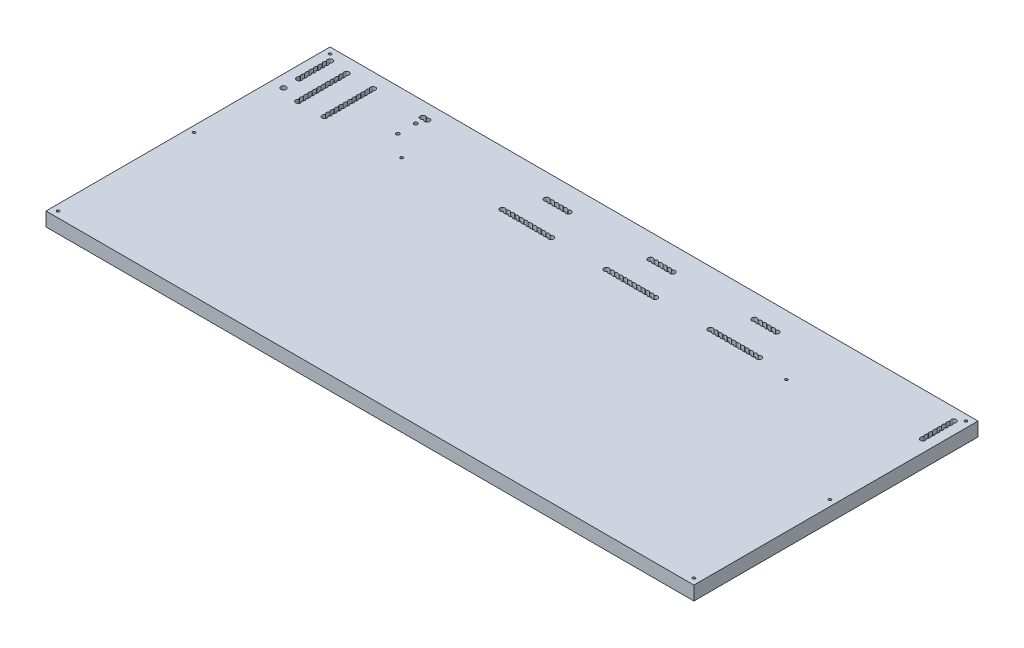
from build123d import *

# Parameters (mm, degrees)
SKETCH_1_W      = 374
SKETCH_1_H      = 164
SKETCH_1_R      = 0.7835
SKETCH_1_R_2    = 1.5
SKETCH_1_R_3    = 1
EXTRUDE_1_DEPTH = 8


with BuildPart() as part:
    # 草图1 → 凸台-拉伸1 (new body)
    with BuildSketch(Plane(origin=(0, 0, 0), x_dir=(1, 0, 0), z_dir=(0, 1, 0))):
        Rectangle(SKETCH_1_W, SKETCH_1_H)
        with Locations(Location((-183.5, -78.5, 0), (0, 0, 270))):
            Circle(SKETCH_1_R, mode=Mode.SUBTRACT)
        with Locations(Location((183.5, -78.5, 0), (0, 0, 270))):
            Circle(SKETCH_1_R, mode=Mode.SUBTRACT)
        with Locations(Location((-183.5, 0, 0), (0, 0, 270))):
            Circle(SKETCH_1_R, mode=Mode.SUBTRACT)
        with Locations(Location((-180, 48.1, 0), (0, 0, 270))):
            Circle(SKETCH_1_R_2, mode=Mode.SUBTRACT)
        with BuildLine():
            ThreePointArc((-169.796185442, 72.253), (-169.723507352, 74.835874359), (-167.498, 73.523))
            ThreePointArc((-167.498, 73.523), (-167.685125641, 72.797492648), (-168.199814558, 72.253))
            ThreePointArc((-168.199814558, 72.253), (-167.685125641, 71.708507352), (-167.498, 70.983))
            ThreePointArc((-167.498, 70.983), (-167.685125641, 70.257492648), (-168.199814558, 69.713))
            ThreePointArc((-168.199814558, 69.713), (-167.685125641, 69.168507352), (-167.498, 68.443))
            ThreePointArc((-167.498, 68.443), (-167.685125641, 67.717492648), (-168.199814558, 67.173))
            ThreePointArc((-168.199814558, 67.173), (-167.685125641, 66.628507352), (-167.498, 65.903))
            ThreePointArc((-167.498, 65.903), (-167.685125641, 65.177492648), (-168.199814558, 64.633))
            ThreePointArc((-168.199814558, 64.633), (-167.685125641, 64.088507352), (-167.498, 63.363))
            ThreePointArc((-167.498, 63.363), (-167.685125641, 62.637492648), (-168.199814558, 62.093))
            ThreePointArc((-168.199814558, 62.093), (-167.685125641, 61.548507352), (-167.498, 60.823))
            ThreePointArc((-167.498, 60.823), (-167.685125641, 60.097492648), (-168.199814558, 59.553))
            ThreePointArc((-168.199814558, 59.553), (-167.685125641, 59.008507352), (-167.498, 58.283))
            ThreePointArc((-167.498, 58.283), (-167.685125641, 57.557492648), (-168.199814558, 57.013))
            ThreePointArc((-168.199814558, 57.013), (-167.685125641, 56.468507352), (-167.498, 55.743))
            ThreePointArc((-167.498, 55.743), (-167.685125641, 55.017492648), (-168.199814558, 54.473))
            ThreePointArc((-168.199814558, 54.473), (-167.685125641, 53.928507352), (-167.498, 53.203))
            ThreePointArc((-167.498, 53.203), (-167.685125641, 52.477492648), (-168.199814558, 51.933))
            ThreePointArc((-168.199814558, 51.933), (-167.685125641, 51.388507352), (-167.498, 50.663))
            ThreePointArc((-167.498, 50.663), (-167.685125641, 49.937492648), (-168.199814558, 49.393))
            ThreePointArc((-168.199814558, 49.393), (-167.685125641, 48.848507352), (-167.498, 48.123))
            ThreePointArc((-167.498, 48.123), (-167.685125641, 47.397492648), (-168.199814558, 46.853))
            ThreePointArc((-168.199814558, 46.853), (-167.685125641, 46.308507352), (-167.498, 45.583))
            ThreePointArc((-167.498, 45.583), (-169.723507352, 44.270125641), (-169.796185442, 46.853))
            ThreePointArc((-169.796185442, 46.853), (-170.498, 48.123), (-169.796185442, 49.393))
            ThreePointArc((-169.796185442, 49.393), (-170.498, 50.663), (-169.796185442, 51.933))
            ThreePointArc((-169.796185442, 51.933), (-170.498, 53.203), (-169.796185442, 54.473))
            ThreePointArc((-169.796185442, 54.473), (-170.498, 55.743), (-169.796185442, 57.013))
            ThreePointArc((-169.796185442, 57.013), (-170.498, 58.283), (-169.796185442, 59.553))
            ThreePointArc((-169.796185442, 59.553), (-170.498, 60.823), (-169.796185442, 62.093))
            ThreePointArc((-169.796185442, 62.093), (-170.498, 63.363), (-169.796185442, 64.633))
            ThreePointArc((-169.796185442, 64.633), (-170.498, 65.903), (-169.796185442, 67.173))
            ThreePointArc((-169.796185442, 67.173), (-170.498, 68.443), (-169.796185442, 69.713))
            ThreePointArc((-169.796185442, 69.713), (-170.498, 70.983), (-169.796185442, 72.253))
        make_face(mode=Mode.SUBTRACT)
        with BuildLine():
            ThreePointArc((-154.556185442, 72.253), (-154.483507352, 74.835874359), (-152.258, 73.523))
            ThreePointArc((-152.258, 73.523), (-152.445125641, 72.797492648), (-152.959814558, 72.253))
            ThreePointArc((-152.959814558, 72.253), (-152.445125641, 71.708507352), (-152.258, 70.983))
            ThreePointArc((-152.258, 70.983), (-152.445125641, 70.257492648), (-152.959814558, 69.713))
            ThreePointArc((-152.959814558, 69.713), (-152.445125641, 69.168507352), (-152.258, 68.443))
            ThreePointArc((-152.258, 68.443), (-152.445125641, 67.717492648), (-152.959814558, 67.173))
            ThreePointArc((-152.959814558, 67.173), (-152.445125641, 66.628507352), (-152.258, 65.903))
            ThreePointArc((-152.258, 65.903), (-152.445125641, 65.177492648), (-152.959814558, 64.633))
            ThreePointArc((-152.959814558, 64.633), (-152.445125641, 64.088507352), (-152.258, 63.363))
            ThreePointArc((-152.258, 63.363), (-152.445125641, 62.637492648), (-152.959814558, 62.093))
            ThreePointArc((-152.959814558, 62.093), (-152.445125641, 61.548507352), (-152.258, 60.823))
            ThreePointArc((-152.258, 60.823), (-152.445125641, 60.097492648), (-152.959814558, 59.553))
            ThreePointArc((-152.959814558, 59.553), (-152.445125641, 59.008507352), (-152.258, 58.283))
            ThreePointArc((-152.258, 58.283), (-152.445125641, 57.557492648), (-152.959814558, 57.013))
            ThreePointArc((-152.959814558, 57.013), (-152.445125641, 56.468507352), (-152.258, 55.743))
            ThreePointArc((-152.258, 55.743), (-152.445125641, 55.017492648), (-152.959814558, 54.473))
            ThreePointArc((-152.959814558, 54.473), (-152.445125641, 53.928507352), (-152.258, 53.203))
            ThreePointArc((-152.258, 53.203), (-152.445125641, 52.477492648), (-152.959814558, 51.933))
            ThreePointArc((-152.959814558, 51.933), (-152.445125641, 51.388507352), (-152.258, 50.663))
            ThreePointArc((-152.258, 50.663), (-152.445125641, 49.937492648), (-152.959814558, 49.393))
            ThreePointArc((-152.959814558, 49.393), (-152.445125641, 48.848507352), (-152.258, 48.123))
            ThreePointArc((-152.258, 48.123), (-152.445125641, 47.397492648), (-152.959814558, 46.853))
            ThreePointArc((-152.959814558, 46.853), (-152.445125641, 46.308507352), (-152.258, 45.583))
            ThreePointArc((-152.258, 45.583), (-154.483507352, 44.270125641), (-154.556185442, 46.853))
            ThreePointArc((-154.556185442, 46.853), (-155.258, 48.123), (-154.556185442, 49.393))
            ThreePointArc((-154.556185442, 49.393), (-155.258, 50.663), (-154.556185442, 51.933))
            ThreePointArc((-154.556185442, 51.933), (-155.258, 53.203), (-154.556185442, 54.473))
            ThreePointArc((-154.556185442, 54.473), (-155.258, 55.743), (-154.556185442, 57.013))
            ThreePointArc((-154.556185442, 57.013), (-155.258, 58.283), (-154.556185442, 59.553))
            ThreePointArc((-154.556185442, 59.553), (-155.258, 60.823), (-154.556185442, 62.093))
            ThreePointArc((-154.556185442, 62.093), (-155.258, 63.363), (-154.556185442, 64.633))
            ThreePointArc((-154.556185442, 64.633), (-155.258, 65.903), (-154.556185442, 67.173))
            ThreePointArc((-154.556185442, 67.173), (-155.258, 68.443), (-154.556185442, 69.713))
            ThreePointArc((-154.556185442, 69.713), (-155.258, 70.983), (-154.556185442, 72.253))
        make_face(mode=Mode.SUBTRACT)
        with Locations(Location((-111, 47.3, 0), (0, 0, 270))):
            Circle(SKETCH_1_R, mode=Mode.SUBTRACT)
        with Locations(Location((-124.018, 58.15, 0), (0, 0, 270))):
            Circle(SKETCH_1_R_3, mode=Mode.SUBTRACT)
        with BuildLine():
            ThreePointArc((-180.798185442, 73.73), (-180.725507352, 76.312874359), (-178.5, 75))
            ThreePointArc((-178.5, 75), (-178.687125641, 74.274492648), (-179.201814558, 73.73))
            ThreePointArc((-179.201814558, 73.73), (-178.687125641, 73.185507352), (-178.5, 72.46))
            ThreePointArc((-178.5, 72.46), (-178.687125641, 71.734492648), (-179.201814558, 71.19))
            ThreePointArc((-179.201814558, 71.19), (-178.687125641, 70.645507352), (-178.5, 69.92))
            ThreePointArc((-178.5, 69.92), (-178.687125641, 69.194492648), (-179.201814558, 68.65))
            ThreePointArc((-179.201814558, 68.65), (-178.687125641, 68.105507352), (-178.5, 67.38))
            ThreePointArc((-178.5, 67.38), (-178.687125641, 66.654492648), (-179.201814558, 66.11))
            ThreePointArc((-179.201814558, 66.11), (-178.687125641, 65.565507352), (-178.5, 64.84))
            ThreePointArc((-178.5, 64.84), (-178.687125641, 64.114492648), (-179.201814558, 63.57))
            ThreePointArc((-179.201814558, 63.57), (-178.687125641, 63.025507352), (-178.5, 62.3))
            ThreePointArc((-178.5, 62.3), (-178.687125641, 61.574492648), (-179.201814558, 61.03))
            ThreePointArc((-179.201814558, 61.03), (-178.687125641, 60.485507352), (-178.5, 59.76))
            ThreePointArc((-178.5, 59.76), (-178.687125641, 59.034492648), (-179.201814558, 58.49))
            ThreePointArc((-179.201814558, 58.49), (-178.687125641, 57.945507352), (-178.5, 57.22))
            ThreePointArc((-178.5, 57.22), (-180.725507352, 55.907125641), (-180.798185442, 58.49))
            ThreePointArc((-180.798185442, 58.49), (-181.5, 59.76), (-180.798185442, 61.03))
            ThreePointArc((-180.798185442, 61.03), (-181.5, 62.3), (-180.798185442, 63.57))
            ThreePointArc((-180.798185442, 63.57), (-181.5, 64.84), (-180.798185442, 66.11))
            ThreePointArc((-180.798185442, 66.11), (-181.5, 67.38), (-180.798185442, 68.65))
            ThreePointArc((-180.798185442, 68.65), (-181.5, 69.92), (-180.798185442, 71.19))
            ThreePointArc((-180.798185442, 71.19), (-181.5, 72.46), (-180.798185442, 73.73))
        make_face(mode=Mode.SUBTRACT)
        with Locations(Location((-183.5, 78.5, 0), (0, 0, 270))):
            Circle(SKETCH_1_R, mode=Mode.SUBTRACT)
        with Locations(Location((-124.018, 68.45, 0), (0, 0, 270))):
            Circle(SKETCH_1_R_3, mode=Mode.SUBTRACT)
        with BuildLine():
            ThreePointArc((-123.7, 72.701814558), (-126.47, 73.5), (-123.7, 74.298185442))
            ThreePointArc((-123.7, 74.298185442), (-122.014668807, 74.941353531), (-120.93, 73.5))
            ThreePointArc((-120.93, 73.5), (-122.014668807, 72.058646469), (-123.7, 72.701814558))
        make_face(mode=Mode.SUBTRACT)
        with BuildLine():
            ThreePointArc((-54.698, 49.737814558), (-57.468, 50.536), (-54.698, 51.334185442))
            ThreePointArc((-54.698, 51.334185442), (-53.428, 52.036), (-52.158, 51.334185442))
            ThreePointArc((-52.158, 51.334185442), (-50.888, 52.036), (-49.618, 51.334185442))
            ThreePointArc((-49.618, 51.334185442), (-48.348, 52.036), (-47.078, 51.334185442))
            ThreePointArc((-47.078, 51.334185442), (-45.808, 52.036), (-44.538, 51.334185442))
            ThreePointArc((-44.538, 51.334185442), (-43.268, 52.036), (-41.998, 51.334185442))
            ThreePointArc((-41.998, 51.334185442), (-40.728, 52.036), (-39.458, 51.334185442))
            ThreePointArc((-39.458, 51.334185442), (-38.188, 52.036), (-36.918, 51.334185442))
            ThreePointArc((-36.918, 51.334185442), (-35.648, 52.036), (-34.378, 51.334185442))
            ThreePointArc((-34.378, 51.334185442), (-33.108, 52.036), (-31.838, 51.334185442))
            ThreePointArc((-31.838, 51.334185442), (-30.568, 52.036), (-29.298, 51.334185442))
            ThreePointArc((-29.298, 51.334185442), (-27.612668807, 51.977353531), (-26.528, 50.536))
            ThreePointArc((-26.528, 50.536), (-27.612668807, 49.094646469), (-29.298, 49.737814558))
            ThreePointArc((-29.298, 49.737814558), (-30.568, 49.036), (-31.838, 49.737814558))
            ThreePointArc((-31.838, 49.737814558), (-33.108, 49.036), (-34.378, 49.737814558))
            ThreePointArc((-34.378, 49.737814558), (-35.648, 49.036), (-36.918, 49.737814558))
            ThreePointArc((-36.918, 49.737814558), (-38.188, 49.036), (-39.458, 49.737814558))
            ThreePointArc((-39.458, 49.737814558), (-40.728, 49.036), (-41.998, 49.737814558))
            ThreePointArc((-41.998, 49.737814558), (-43.268, 49.036), (-44.538, 49.737814558))
            ThreePointArc((-44.538, 49.737814558), (-45.808, 49.036), (-47.078, 49.737814558))
            ThreePointArc((-47.078, 49.737814558), (-48.348, 49.036), (-49.618, 49.737814558))
            ThreePointArc((-49.618, 49.737814558), (-50.888, 49.036), (-52.158, 49.737814558))
            ThreePointArc((-52.158, 49.737814558), (-53.428, 49.036), (-54.698, 49.737814558))
        make_face(mode=Mode.SUBTRACT)
        with BuildLine():
            ThreePointArc((-47.078, 67.517814558), (-49.848, 68.316), (-47.078, 69.114185442))
            ThreePointArc((-47.078, 69.114185442), (-45.808, 69.816), (-44.538, 69.114185442))
            ThreePointArc((-44.538, 69.114185442), (-43.268, 69.816), (-41.998, 69.114185442))
            ThreePointArc((-41.998, 69.114185442), (-40.728, 69.816), (-39.458, 69.114185442))
            ThreePointArc((-39.458, 69.114185442), (-38.188, 69.816), (-36.918, 69.114185442))
            ThreePointArc((-36.918, 69.114185442), (-35.232668807, 69.757353531), (-34.148, 68.316))
            ThreePointArc((-34.148, 68.316), (-35.232668807, 66.874646469), (-36.918, 67.517814558))
            ThreePointArc((-36.918, 67.517814558), (-38.188, 66.816), (-39.458, 67.517814558))
            ThreePointArc((-39.458, 67.517814558), (-40.728, 66.816), (-41.998, 67.517814558))
            ThreePointArc((-41.998, 67.517814558), (-43.268, 66.816), (-44.538, 67.517814558))
            ThreePointArc((-44.538, 67.517814558), (-45.808, 66.816), (-47.078, 67.517814558))
        make_face(mode=Mode.SUBTRACT)
        with Locations(Location((183.5, 0, 0), (0, 0, 270))):
            Circle(SKETCH_1_R, mode=Mode.SUBTRACT)
        with BuildLine():
            ThreePointArc((5.302, 49.737814558), (2.532, 50.536), (5.302, 51.334185442))
            ThreePointArc((5.302, 51.334185442), (6.572, 52.036), (7.842, 51.334185442))
            ThreePointArc((7.842, 51.334185442), (9.112, 52.036), (10.382, 51.334185442))
            ThreePointArc((10.382, 51.334185442), (11.652, 52.036), (12.922, 51.334185442))
            ThreePointArc((12.922, 51.334185442), (14.192, 52.036), (15.462, 51.334185442))
            ThreePointArc((15.462, 51.334185442), (16.732, 52.036), (18.002, 51.334185442))
            ThreePointArc((18.002, 51.334185442), (19.272, 52.036), (20.542, 51.334185442))
            ThreePointArc((20.542, 51.334185442), (21.812, 52.036), (23.082, 51.334185442))
            ThreePointArc((23.082, 51.334185442), (24.352, 52.036), (25.622, 51.334185442))
            ThreePointArc((25.622, 51.334185442), (26.892, 52.036), (28.162, 51.334185442))
            ThreePointArc((28.162, 51.334185442), (29.432, 52.036), (30.702, 51.334185442))
            ThreePointArc((30.702, 51.334185442), (32.387331193, 51.977353531), (33.472, 50.536))
            ThreePointArc((33.472, 50.536), (32.387331193, 49.094646469), (30.702, 49.737814558))
            ThreePointArc((30.702, 49.737814558), (29.432, 49.036), (28.162, 49.737814558))
            ThreePointArc((28.162, 49.737814558), (26.892, 49.036), (25.622, 49.737814558))
            ThreePointArc((25.622, 49.737814558), (24.352, 49.036), (23.082, 49.737814558))
            ThreePointArc((23.082, 49.737814558), (21.812, 49.036), (20.542, 49.737814558))
            ThreePointArc((20.542, 49.737814558), (19.272, 49.036), (18.002, 49.737814558))
            ThreePointArc((18.002, 49.737814558), (16.732, 49.036), (15.462, 49.737814558))
            ThreePointArc((15.462, 49.737814558), (14.192, 49.036), (12.922, 49.737814558))
            ThreePointArc((12.922, 49.737814558), (11.652, 49.036), (10.382, 49.737814558))
            ThreePointArc((10.382, 49.737814558), (9.112, 49.036), (7.842, 49.737814558))
            ThreePointArc((7.842, 49.737814558), (6.572, 49.036), (5.302, 49.737814558))
        make_face(mode=Mode.SUBTRACT)
        with BuildLine():
            ThreePointArc((65.302, 49.737814558), (62.532, 50.536), (65.302, 51.334185442))
            ThreePointArc((65.302, 51.334185442), (66.572, 52.036), (67.842, 51.334185442))
            ThreePointArc((67.842, 51.334185442), (69.112, 52.036), (70.382, 51.334185442))
            ThreePointArc((70.382, 51.334185442), (71.652, 52.036), (72.922, 51.334185442))
            ThreePointArc((72.922, 51.334185442), (74.192, 52.036), (75.462, 51.334185442))
            ThreePointArc((75.462, 51.334185442), (76.732, 52.036), (78.002, 51.334185442))
            ThreePointArc((78.002, 51.334185442), (79.272, 52.036), (80.542, 51.334185442))
            ThreePointArc((80.542, 51.334185442), (81.812, 52.036), (83.082, 51.334185442))
            ThreePointArc((83.082, 51.334185442), (84.352, 52.036), (85.622, 51.334185442))
            ThreePointArc((85.622, 51.334185442), (86.892, 52.036), (88.162, 51.334185442))
            ThreePointArc((88.162, 51.334185442), (89.432, 52.036), (90.702, 51.334185442))
            ThreePointArc((90.702, 51.334185442), (92.387331193, 51.977353531), (93.472, 50.536))
            ThreePointArc((93.472, 50.536), (92.387331193, 49.094646469), (90.702, 49.737814558))
            ThreePointArc((90.702, 49.737814558), (89.432, 49.036), (88.162, 49.737814558))
            ThreePointArc((88.162, 49.737814558), (86.892, 49.036), (85.622, 49.737814558))
            ThreePointArc((85.622, 49.737814558), (84.352, 49.036), (83.082, 49.737814558))
            ThreePointArc((83.082, 49.737814558), (81.812, 49.036), (80.542, 49.737814558))
            ThreePointArc((80.542, 49.737814558), (79.272, 49.036), (78.002, 49.737814558))
            ThreePointArc((78.002, 49.737814558), (76.732, 49.036), (75.462, 49.737814558))
            ThreePointArc((75.462, 49.737814558), (74.192, 49.036), (72.922, 49.737814558))
            ThreePointArc((72.922, 49.737814558), (71.652, 49.036), (70.382, 49.737814558))
            ThreePointArc((70.382, 49.737814558), (69.112, 49.036), (67.842, 49.737814558))
            ThreePointArc((67.842, 49.737814558), (66.572, 49.036), (65.302, 49.737814558))
        make_face(mode=Mode.SUBTRACT)
        with BuildLine():
            ThreePointArc((12.922, 67.517814558), (10.152, 68.316), (12.922, 69.114185442))
            ThreePointArc((12.922, 69.114185442), (14.192, 69.816), (15.462, 69.114185442))
            ThreePointArc((15.462, 69.114185442), (16.732, 69.816), (18.002, 69.114185442))
            ThreePointArc((18.002, 69.114185442), (19.272, 69.816), (20.542, 69.114185442))
            ThreePointArc((20.542, 69.114185442), (21.812, 69.816), (23.082, 69.114185442))
            ThreePointArc((23.082, 69.114185442), (24.767331193, 69.757353531), (25.852, 68.316))
            ThreePointArc((25.852, 68.316), (24.767331193, 66.874646469), (23.082, 67.517814558))
            ThreePointArc((23.082, 67.517814558), (21.812, 66.816), (20.542, 67.517814558))
            ThreePointArc((20.542, 67.517814558), (19.272, 66.816), (18.002, 67.517814558))
            ThreePointArc((18.002, 67.517814558), (16.732, 66.816), (15.462, 67.517814558))
            ThreePointArc((15.462, 67.517814558), (14.192, 66.816), (12.922, 67.517814558))
        make_face(mode=Mode.SUBTRACT)
        with BuildLine():
            ThreePointArc((72.922, 67.517814558), (70.152, 68.316), (72.922, 69.114185442))
            ThreePointArc((72.922, 69.114185442), (74.192, 69.816), (75.462, 69.114185442))
            ThreePointArc((75.462, 69.114185442), (76.732, 69.816), (78.002, 69.114185442))
            ThreePointArc((78.002, 69.114185442), (79.272, 69.816), (80.542, 69.114185442))
            ThreePointArc((80.542, 69.114185442), (81.812, 69.816), (83.082, 69.114185442))
            ThreePointArc((83.082, 69.114185442), (84.767331193, 69.757353531), (85.852, 68.316))
            ThreePointArc((85.852, 68.316), (84.767331193, 66.874646469), (83.082, 67.517814558))
            ThreePointArc((83.082, 67.517814558), (81.812, 66.816), (80.542, 67.517814558))
            ThreePointArc((80.542, 67.517814558), (79.272, 66.816), (78.002, 67.517814558))
            ThreePointArc((78.002, 67.517814558), (76.732, 66.816), (75.462, 67.517814558))
            ThreePointArc((75.462, 67.517814558), (74.192, 66.816), (72.922, 67.517814558))
        make_face(mode=Mode.SUBTRACT)
        with Locations(Location((111, 47.4, 0), (0, 0, 270))):
            Circle(SKETCH_1_R, mode=Mode.SUBTRACT)
        with BuildLine():
            ThreePointArc((179.201814558, 73.73), (179.274492648, 76.312874359), (181.5, 75))
            ThreePointArc((181.5, 75), (181.312874359, 74.274492648), (180.798185442, 73.73))
            ThreePointArc((180.798185442, 73.73), (181.312874359, 73.185507352), (181.5, 72.46))
            ThreePointArc((181.5, 72.46), (181.312874359, 71.734492648), (180.798185442, 71.19))
            ThreePointArc((180.798185442, 71.19), (181.312874359, 70.645507352), (181.5, 69.92))
            ThreePointArc((181.5, 69.92), (181.312874359, 69.194492648), (180.798185442, 68.65))
            ThreePointArc((180.798185442, 68.65), (181.312874359, 68.105507352), (181.5, 67.38))
            ThreePointArc((181.5, 67.38), (181.312874359, 66.654492648), (180.798185442, 66.11))
            ThreePointArc((180.798185442, 66.11), (181.312874359, 65.565507352), (181.5, 64.84))
            ThreePointArc((181.5, 64.84), (181.312874359, 64.114492648), (180.798185442, 63.57))
            ThreePointArc((180.798185442, 63.57), (181.312874359, 63.025507352), (181.5, 62.3))
            ThreePointArc((181.5, 62.3), (181.312874359, 61.574492648), (180.798185442, 61.03))
            ThreePointArc((180.798185442, 61.03), (181.312874359, 60.485507352), (181.5, 59.76))
            ThreePointArc((181.5, 59.76), (181.312874359, 59.034492648), (180.798185442, 58.49))
            ThreePointArc((180.798185442, 58.49), (181.312874359, 57.945507352), (181.5, 57.22))
            ThreePointArc((181.5, 57.22), (179.274492648, 55.907125641), (179.201814558, 58.49))
            ThreePointArc((179.201814558, 58.49), (178.5, 59.76), (179.201814558, 61.03))
            ThreePointArc((179.201814558, 61.03), (178.5, 62.3), (179.201814558, 63.57))
            ThreePointArc((179.201814558, 63.57), (178.5, 64.84), (179.201814558, 66.11))
            ThreePointArc((179.201814558, 66.11), (178.5, 67.38), (179.201814558, 68.65))
            ThreePointArc((179.201814558, 68.65), (178.5, 69.92), (179.201814558, 71.19))
            ThreePointArc((179.201814558, 71.19), (178.5, 72.46), (179.201814558, 73.73))
        make_face(mode=Mode.SUBTRACT)
        with Locations(Location((183.5, 78.5, 0), (0, 0, 270))):
            Circle(SKETCH_1_R, mode=Mode.SUBTRACT)
    extrude(amount=EXTRUDE_1_DEPTH)


solid = part.part
